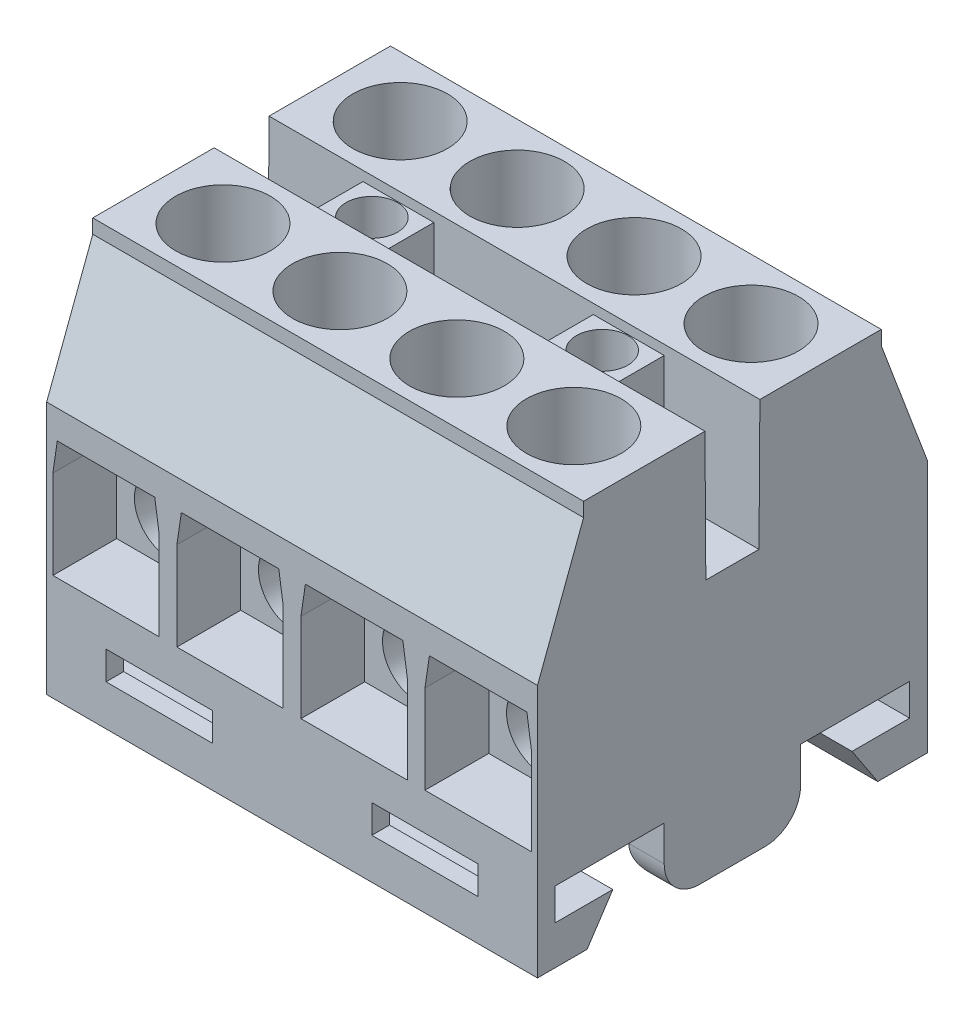
from build123d import *

# Parameters (mm, degrees)
SKETCH1_W                                   = 27.7
SKETCH1_H                                   = 22
BOSS_EXTRUDE1_DEPTH                         = 22
CUT_EXTRUDE1_DEPTH                          = 38.04443278
CUT_EXTRUDE2_DEPTH                          = 38.04443278
SKETCH4_W                                   = 13.5
SKETCH4_H                                   = 4
CUT_EXTRUDE3_DEPTH                          = 38.04443278
SKETCH5_W                                   = 3.25
SKETCH5_H                                   = 1.8
CUT_EXTRUDE4_DEPTH                          = 38.04443278
CUT_EXTRUDE5_DEPTH                          = 38.04443278
SKETCH7_W                                   = 6
SKETCH7_H                                   = 1.6
CUT_EXTRUDE6_DEPTH                          = 35.056166842
SKETCH8_R                                   = 2.675
CUT_EXTRUDE7_DEPTH                          = 4.5
CUT_EXTRUDE8_DEPTH                          = 3.6
SKETCH10_R                                  = 2
CUT_EXTRUDE9_DEPTH                          = 3
SKETCH15_W                                  = 4
SKETCH15_H                                  = 3
SKETCH15_R                                  = 1.45
BOSS_EXTRUDE4_DEPTH                         = 6.8
SKETCH11_W                                  = 10.5
SKETCH11_H                                  = 7.7
BOSS_EXTRUDE2_DEPTH                         = 4
SKETCH12_R                                  = 3
CUT_EXTRUDE10_DEPTH                         = 3.5
SKETCH13_R                                  = 1.5
REIK_MAHTUU_3_3MM_NIITTI_L_PI_KOSKA_M_DEPTH = 33.905508657
FILLET2_R                                   = 2
FILLET3_R                                   = 1
BOSS_EXTRUDE5_DEPTH                         = 1.15
SKETCH18_W                                  = 1
SKETCH18_H                                  = 1.8
BOSS_EXTRUDE6_DEPTH                         = 4
SKETCH19_W                                  = 8.5
SKETCH19_H                                  = 4
CUT_EXTRUDE12_DEPTH                         = 35.699351643


with BuildPart() as part:
    # Sketch1 → Boss-Extrude1 (new body)
    with BuildSketch(Plane(origin=(0, 0, 0), x_dir=(1, 0, 0), z_dir=(0, 1, 0))):
        Rectangle(SKETCH1_W, SKETCH1_H)
    extrude(amount=BOSS_EXTRUDE1_DEPTH)

    # Sketch2 → Cut-Extrude1 (cut, through all)
    with BuildSketch(Plane(origin=(13.85, 0, 0), x_dir=(0, 0, -1), z_dir=(1, 0, 0))):
        Polygon((-8.4, 22), (-8.4, 21.2), (-11, 14.3), (-11, 22), align=None)
        Polygon((11, 22), (11, 14.3), (8.4, 21.2), (8.4, 22), align=None)
    extrude(amount=-CUT_EXTRUDE1_DEPTH, mode=Mode.SUBTRACT)

    # Sketch3 → Cut-Extrude2 (cut, through all)
    with BuildSketch(Plane(origin=(13.85, 0, 0), x_dir=(0, 0, -1), z_dir=(1, 0, 0))):
        Polygon((-1.55, 22), (1.55, 22), (1.5, 14.700171235), (-1.5, 14.700171235), align=None)
    extrude(amount=-CUT_EXTRUDE2_DEPTH, mode=Mode.SUBTRACT)

    # Sketch4 → Cut-Extrude3 (cut, through all)
    with BuildSketch(Plane(origin=(13.85, 0, 0), x_dir=(0, 0, -1), z_dir=(1, 0, 0))):
        with Locations((0, 2)):
            Rectangle(SKETCH4_W, SKETCH4_H)
    extrude(amount=-CUT_EXTRUDE3_DEPTH, mode=Mode.SUBTRACT)

    # Sketch5 → Cut-Extrude4 (cut, through all)
    with BuildSketch(Plane(origin=(13.85, 0, 0), x_dir=(0, 0, -1), z_dir=(1, 0, 0))):
        with Locations((-8.375, 3.1)):
            Rectangle(SKETCH5_W, SKETCH5_H)
        with Locations((8.375, 3.1)):
            Rectangle(SKETCH5_W, SKETCH5_H)
    extrude(amount=-CUT_EXTRUDE4_DEPTH, mode=Mode.SUBTRACT)

    # Sketch6 → Cut-Extrude5 (cut, through all)
    with BuildSketch(Plane(origin=(13.85, 0, 0), x_dir=(0, 0, -1), z_dir=(1, 0, 0))):
        Polygon((-8.2, 0), (-6.75, 2.2), (-6.75, 0), align=None)
        Polygon((6.75, 0), (8.2, 0), (6.75, 2.2), align=None)
    extrude(amount=-CUT_EXTRUDE5_DEPTH, mode=Mode.SUBTRACT)

    # Sketch7 → Cut-Extrude6 (cut, through all)
    with BuildSketch(Plane.XY.offset(11)):
        with Locations((-7.5, 3.1)):
            Rectangle(SKETCH7_W, SKETCH7_H)
        with Locations((7.5, 3.1)):
            Rectangle(SKETCH7_W, SKETCH7_H)
    extrude(amount=-CUT_EXTRUDE6_DEPTH, mode=Mode.SUBTRACT)

    # Sketch8 → Cut-Extrude7 (cut)
    with BuildSketch(Plane(origin=(0, 22, 0), x_dir=(1, 0, 0), z_dir=(0, 1, 0))):
        with Locations(Location((-9.9, 5, 0), (0, 0, 270))):
            Circle(SKETCH8_R)
        with Locations(Location((-3.3, 5, 0), (0, 0, 270))):
            Circle(SKETCH8_R)
        with Locations(Location((3.3, 5, 0), (0, 0, 270))):
            Circle(SKETCH8_R)
        with Locations(Location((9.9, 5, 0), (0, 0, 270))):
            Circle(SKETCH8_R)
        with Locations(Location((9.9, -5, 0), (0, 0, 270))):
            Circle(SKETCH8_R)
        with Locations(Location((3.3, -5, 0), (0, 0, 270))):
            Circle(SKETCH8_R)
        with Locations(Location((-3.3, -5, 0), (0, 0, 270))):
            Circle(SKETCH8_R)
        with Locations(Location((-9.9, -5, 0), (0, 0, 270))):
            Circle(SKETCH8_R)
    extrude(amount=-CUT_EXTRUDE7_DEPTH, mode=Mode.SUBTRACT)

    # Sketch9 → Cut-Extrude8 (cut)
    with BuildSketch(Plane.XY.offset(11)):
        Polygon((-7.75, 12.7), (-7.5, 11), (-7.5, 6), (-13.5, 6), (-13.5, 11), (-13.25, 12.7), align=None)
        Polygon((-0.75, 12.7), (-0.5, 11), (-0.5, 6), (-6.5, 6), (-6.5, 11), (-6.25, 12.7), align=None)
        Polygon((6.25, 12.7), (6.5, 11), (6.5, 6), (0.5, 6), (0.5, 11), (0.75, 12.7), align=None)
        Polygon((13.25, 12.7), (13.5, 11), (13.5, 6), (7.5, 6), (7.5, 11), (7.75, 12.7), align=None)
    cut_extrude8 = extrude(amount=-CUT_EXTRUDE8_DEPTH, mode=Mode.SUBTRACT)

    # Mirror1: Cut-Extrude8 across plane
    add(cut_extrude8.mirror(Plane.XY), mode=Mode.SUBTRACT)

    # Sketch10 → Cut-Extrude9 (cut)
    with BuildSketch(Plane.XY.offset(7.4)):
        with Locations((-10.5, 8.5)):
            Circle(SKETCH10_R)
        with Locations((-3.5, 8.5)):
            Circle(SKETCH10_R)
        with Locations((3.5, 8.5)):
            Circle(SKETCH10_R)
        with Locations((10.5, 8.5)):
            Circle(SKETCH10_R)
    cut_extrude9 = extrude(amount=-CUT_EXTRUDE9_DEPTH, mode=Mode.SUBTRACT)

    # Mirror2: Cut-Extrude9 across plane
    add(cut_extrude9.mirror(Plane.XY), mode=Mode.SUBTRACT)

    # Sketch15 → Boss-Extrude4 (add)
    # profile 1 of 2: a face of its own
    with BuildSketch(Plane(origin=(0, 14.700171235, 0), x_dir=(1, 0, 0), z_dir=(0, 1, 0))):
        with Locations((-6.5, 0)):
            Rectangle(SKETCH15_W, SKETCH15_H)
        with Locations(Location((-6.5, 0, 0), (0, 0, 270))):
            Circle(SKETCH15_R, mode=Mode.SUBTRACT)
    # profile 2 of 2: a face of its own
    with BuildSketch(Plane(origin=(0, 14.700171235, 0), x_dir=(1, 0, 0), z_dir=(0, 1, 0))):
        with Locations((6.5, 0)):
            Rectangle(SKETCH15_W, SKETCH15_H)
        with Locations(Location((6.5, 0, 0), (0, 0, 270))):
            Circle(SKETCH15_R, mode=Mode.SUBTRACT)
    extrude(amount=BOSS_EXTRUDE4_DEPTH)

    # Sketch11 → Boss-Extrude2 (add)
    with BuildSketch(Plane.XZ.offset(-4)):
        with Locations((17.1, 0)):
            Rectangle(SKETCH11_W, SKETCH11_H)
    extrude(amount=BOSS_EXTRUDE2_DEPTH)

    # Sketch12 → Cut-Extrude10 (cut)
    with BuildSketch(Plane(origin=(0, 4, 0), x_dir=(1, 0, 0), z_dir=(0, 1, 0))):
        with Locations(Location((18.35, 0, 0), (0, 0, 270))):
            Circle(SKETCH12_R)
    extrude(amount=-CUT_EXTRUDE10_DEPTH, mode=Mode.SUBTRACT)

    # Sketch13 → Reikä. Mahtuu 3,3mm niitti läpi, koska materiaali muovia (cut, through all)
    with BuildSketch(Plane(origin=(0, 0.5, 0), x_dir=(1, 0, 0), z_dir=(0, 1, 0))):
        with Locations(Location((18.35, 0, 0), (0, 0, 270))):
            Circle(SKETCH13_R)
    extrude(amount=-REIK_MAHTUU_3_3MM_NIITTI_L_PI_KOSKA_M_DEPTH, mode=Mode.SUBTRACT)

    # Fillet2
    fillet2_edges = [part.edges().sort_by_distance(p)[0] for p in [
        (17.1, 0, -3.85),
        (11.85, 0, 0),
        (17.1, 0, 3.85),
        (22.35, 0, 0),
    ]]
    fillet(fillet2_edges, radius=FILLET2_R)

    # Fillet3
    fillet3_edges = [part.edges().sort_by_distance(p)[0] for p in [
        (22.35, 3, -3.85),
        (22.35, 3, 3.85),
        (21.642097815, 0.473407966, 3.142097815),
        (21.642097815, 0.473407966, -3.142097815),
    ]]
    fillet(fillet3_edges, radius=FILLET3_R)

    # Sketch16 → Boss-Extrude5 (add, symmetric)
    with BuildSketch(Plane.XY):
        Polygon((11.85, 2), (11.85, 4), (9.85, 4), align=None)
    extrude(amount=BOSS_EXTRUDE5_DEPTH, both=True)

    # Sketch18 → Boss-Extrude6 (add)
    with BuildSketch(Plane.XZ.offset(-4)):
        with Locations((2.35, 9.1)):
            Rectangle(SKETCH18_W, SKETCH18_H)
        with Locations((2.35, -9.1)):
            Rectangle(SKETCH18_W, SKETCH18_H)
    extrude(amount=BOSS_EXTRUDE6_DEPTH)

    # Sketch19 → Cut-Extrude12 (cut, through all)
    with BuildSketch(Plane.XY.offset(3.85)):
        with Locations((18.1, 2)):
            Rectangle(SKETCH19_W, SKETCH19_H)
    extrude(amount=-CUT_EXTRUDE12_DEPTH, mode=Mode.SUBTRACT)


solid = part.part
